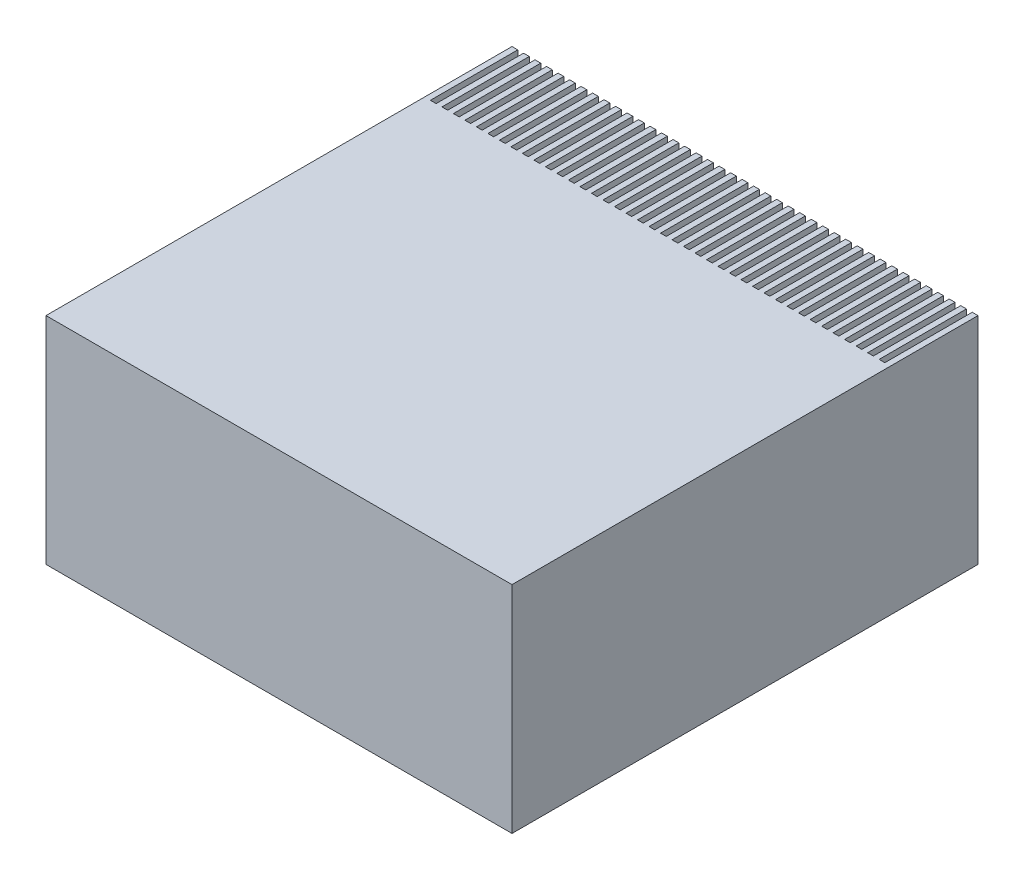
from build123d import *

# Parameters (mm, degrees)
SKETCH1_W                  = 80
SKETCH1_H                  = 80
EXTRUDE1_DEPTH             = 37
ESQUISSE1_W                = 0.987654321
ESQUISSE1_H                = 37
ENL_V_MAT_EXTRU_1_DEPTH    = 15
R_P_TITION_LIN_AIRE1_COUNT = 40
R_P_TITION_LIN_AIRE1_PITCH = 1.975308642


with BuildPart() as part:
    # Sketch1 → Extrude1 (new body)
    with BuildSketch(Plane(origin=(0, 0, 0), x_dir=(1, 0, 0), z_dir=(0, 1, 0))):
        with Locations((40, 40)):
            Rectangle(SKETCH1_W, SKETCH1_H)
    extrude(amount=EXTRUDE1_DEPTH)

    # Esquisse1 → Enlèv. mat.-Extru.1 (cut)
    with BuildSketch(Plane.XY.offset(-80)):
        with Locations((1.481481161, 18.5)):
            Rectangle(ESQUISSE1_W, ESQUISSE1_H)
    enl_v_mat_extru_1 = extrude(amount=ENL_V_MAT_EXTRU_1_DEPTH, mode=Mode.SUBTRACT)

    # Répétition linéaire1: Enlèv. mat.-Extru.1 ×40
    with Locations(*[(i * R_P_TITION_LIN_AIRE1_PITCH, 0, 0) for i in range(1, R_P_TITION_LIN_AIRE1_COUNT)]):
        add(enl_v_mat_extru_1, mode=Mode.SUBTRACT)


solid = part.part
